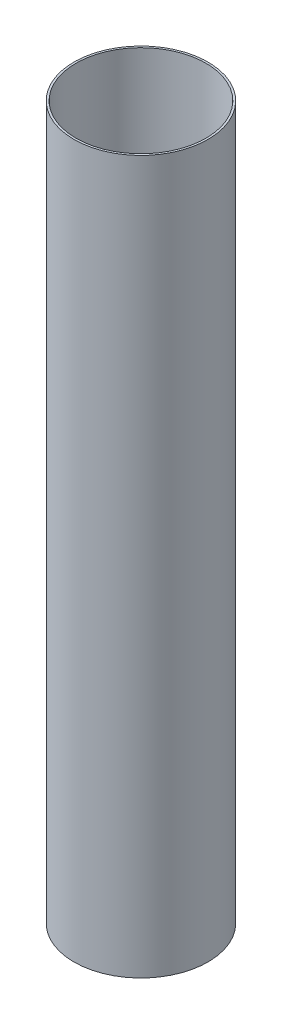
from build123d import *

# Parameters (mm, degrees)
SKETCH1_R           = 52.578
SKETCH1_R_2         = 50.9905
BOSS_EXTRUDE1_DEPTH = 558.8


with BuildPart() as part:
    # Sketch1 → Boss-Extrude1 (new body)
    with BuildSketch(Plane(origin=(0, 0, 0), x_dir=(1, 0, 0), z_dir=(0, 1, 0))):
        with Locations(Location((0, 0, 0), (0, 0, 270))):
            Circle(SKETCH1_R)
        with Locations(Location((0, 0, 0), (0, 0, 270))):
            Circle(SKETCH1_R_2, mode=Mode.SUBTRACT)
    extrude(amount=BOSS_EXTRUDE1_DEPTH)


solid = part.part
